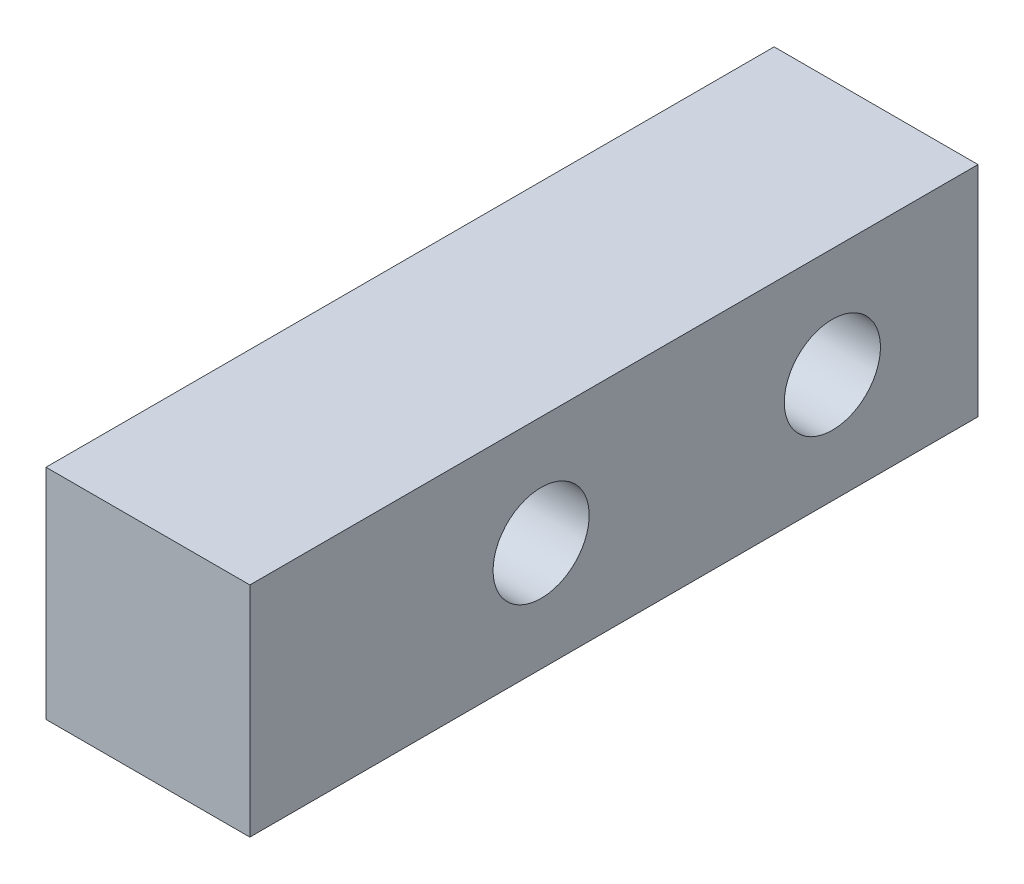
from build123d import *

# Parameters (mm, degrees)
SKETCH1_W                              = 14
SKETCH1_H                              = 15
BOSS_EXTRUDE1_DEPTH                    = 50
CBORE_FOR_M6_HEX_HEAD_BOLT1_AT_2_COUNT = 2
CBORE_FOR_M6_HEX_HEAD_BOLT1_AT_2_PITCH = 20


with BuildPart() as part:
    # Sketch1 → Boss-Extrude1 (new body)
    with BuildSketch(Plane.XY):
        Rectangle(SKETCH1_W, SKETCH1_H)
    extrude(amount=BOSS_EXTRUDE1_DEPTH)

    # Sketch3 → CBORE for M6 Hex Head Bolt1 (revolve, cut)
    with BuildSketch(Plane(origin=(-7, 0, 10), x_dir=(0, 0, 1), z_dir=(0, 1, 0))):
        Polygon((0, 0), (0, 14), (3.3, 14), (3.3, 8), (7.2735, 8), (7.2735, 0.025), (7.2985, 0), align=None)
    cbore_for_m6_hex_head_bolt1 = revolve(axis=Axis((-13.35, 0, 10), (1, 0, 0)), mode=Mode.SUBTRACT)

    # CBORE for M6 Hex Head Bolt1 at 2: CBORE for M6 Hex Head Bolt1 ×2
    with Locations(*[(0, 0, i * CBORE_FOR_M6_HEX_HEAD_BOLT1_AT_2_PITCH) for i in range(1, CBORE_FOR_M6_HEX_HEAD_BOLT1_AT_2_COUNT)]):
        add(cbore_for_m6_hex_head_bolt1, mode=Mode.SUBTRACT)


solid = part.part
